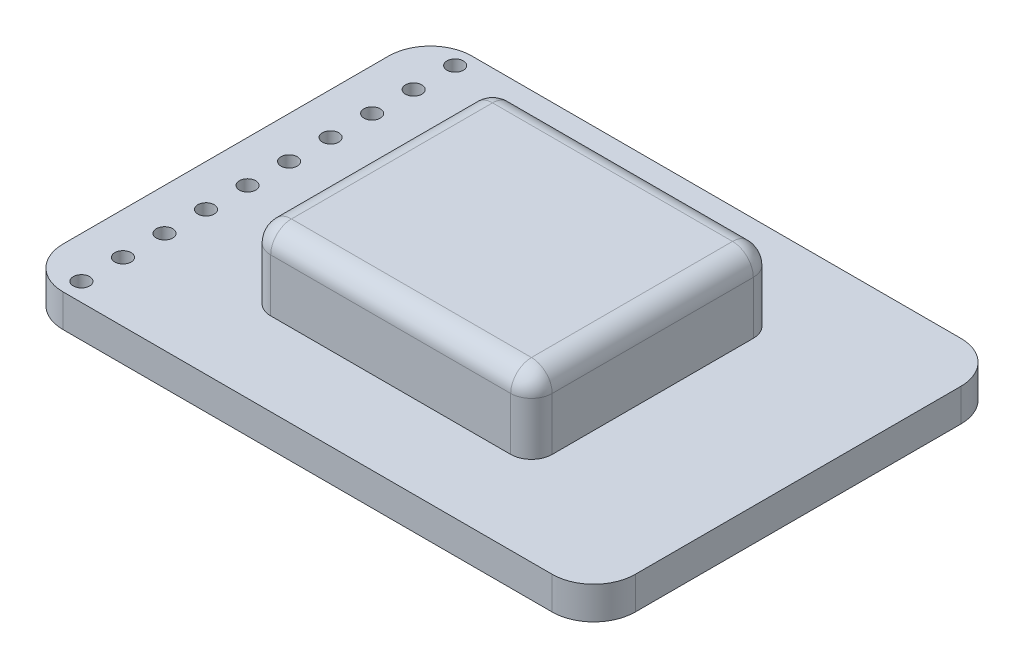
from build123d import *

# Parameters (mm, degrees)
SKETCH1_W           = 35.000000104
SKETCH1_H           = 25
BOSS_EXTRUDE1_DEPTH = 2
FILLET1_R           = 2.54
SKETCH2_W           = 17.220000104
SKETCH2_H           = 14.84
BOSS_EXTRUDE2_DEPTH = 4.5
FILLET2_R           = 1.27
SKETCH3_R           = 0.5
CUT_EXTRUDE1_DEPTH  = 4.5


with BuildPart() as part:
    # Sketch1 → Boss-Extrude1 (new body)
    with BuildSketch(Plane(origin=(0, 0, 0), x_dir=(1, 0, 0), z_dir=(0, 1, 0))):
        with Locations((17.500000052, 12.5)):
            Rectangle(SKETCH1_W, SKETCH1_H)
    extrude(amount=BOSS_EXTRUDE1_DEPTH)

    # Fillet1
    fillet1_edges = [part.edges().sort_by_distance(p)[0] for p in [
        (0, 1, -25),
        (35.000000104, 1, -25),
        (35.000000104, 1, 0),
        (0, 1, 0),
    ]]
    fillet(fillet1_edges, radius=FILLET1_R)

    # Sketch2 → Boss-Extrude2 (add)
    with BuildSketch(Plane(origin=(0, 2, 0), x_dir=(1, 0, 0), z_dir=(0, 1, 0))):
        with Locations((17.500000052, 12.5)):
            Rectangle(SKETCH2_W, SKETCH2_H)
    extrude(amount=BOSS_EXTRUDE2_DEPTH)

    # Fillet2
    fillet2_edges = [part.edges().sort_by_distance(p)[0] for p in [
        (8.89, 4.25, -19.92),
        (8.89, 4.25, -5.08),
        (26.110000104, 4.25, -5.08),
        (26.110000104, 4.25, -19.92),
        (8.89, 6.5, -12.5),
        (17.500000052, 6.5, -5.08),
        (26.110000104, 6.5, -12.5),
        (17.500000052, 6.5, -19.92),
    ]]
    fillet(fillet2_edges, radius=FILLET2_R)

    # Sketch3 → Cut-Extrude1 (cut)
    with BuildSketch(Plane(origin=(0, 2, 0), x_dir=(1, 0, 0), z_dir=(0, 1, 0))):
        with Locations(Location((2.54, 23.984, 0), (0, 0, 270))):
            Circle(SKETCH3_R)
        with Locations(Location((2.54, 21.444, 0), (0, 0, 270))):
            Circle(SKETCH3_R)
        with Locations(Location((2.54, 18.904, 0), (0, 0, 270))):
            Circle(SKETCH3_R)
        with Locations(Location((2.54, 16.364, 0), (0, 0, 270))):
            Circle(SKETCH3_R)
        with Locations(Location((2.54, 13.824, 0), (0, 0, 270))):
            Circle(SKETCH3_R)
        with Locations(Location((2.54, 11.284, 0), (0, 0, 270))):
            Circle(SKETCH3_R)
        with Locations(Location((2.54, 8.744, 0), (0, 0, 270))):
            Circle(SKETCH3_R)
        with Locations(Location((2.54, 6.204, 0), (0, 0, 270))):
            Circle(SKETCH3_R)
        with Locations(Location((2.54, 3.664, 0), (0, 0, 270))):
            Circle(SKETCH3_R)
        with Locations(Location((2.54, 1.124, 0), (0, 0, 270))):
            Circle(SKETCH3_R)
    extrude(amount=-CUT_EXTRUDE1_DEPTH, mode=Mode.SUBTRACT)


solid = part.part
